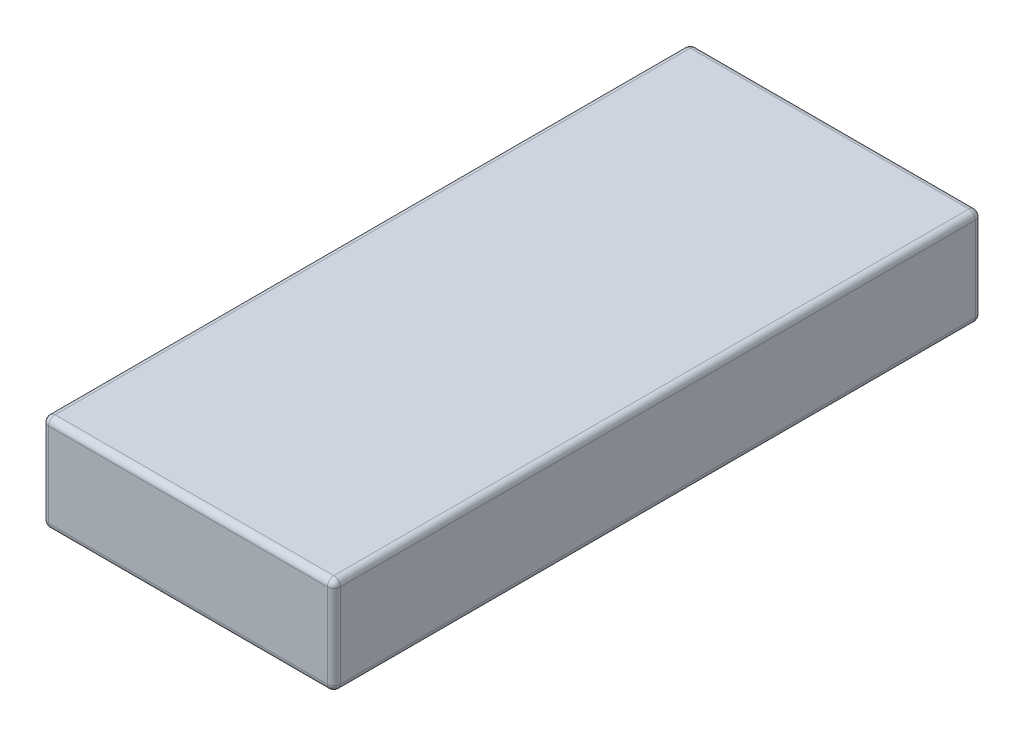
from build123d import *

# Parameters (mm, degrees)
SKETCH1_W           = 900
SKETCH1_H           = 2000
BOSS_EXTRUDE1_DEPTH = 300
FILLET1_R           = 20


with BuildPart() as part:
    # Sketch1 → Boss-Extrude1 (new body)
    with BuildSketch(Plane(origin=(0, 0, 0), x_dir=(1, 0, 0), z_dir=(0, 1, 0))):
        Rectangle(SKETCH1_W, SKETCH1_H)
    extrude(amount=BOSS_EXTRUDE1_DEPTH)

    # Fillet1
    fillet1_edges = [part.edges().sort_by_distance(p)[0] for p in [
        (-450, 300, 0),
        (0, 300, 1000),
        (450, 300, 0),
        (0, 0, 1000),
        (-450, 0, 0),
        (0, 0, -1000),
        (450, 0, 0),
        (450, 150, 1000),
        (-450, 150, 1000),
        (-450, 150, -1000),
        (450, 150, -1000),
        (0, 300, -1000),
    ]]
    fillet(fillet1_edges, radius=FILLET1_R)


solid = part.part
